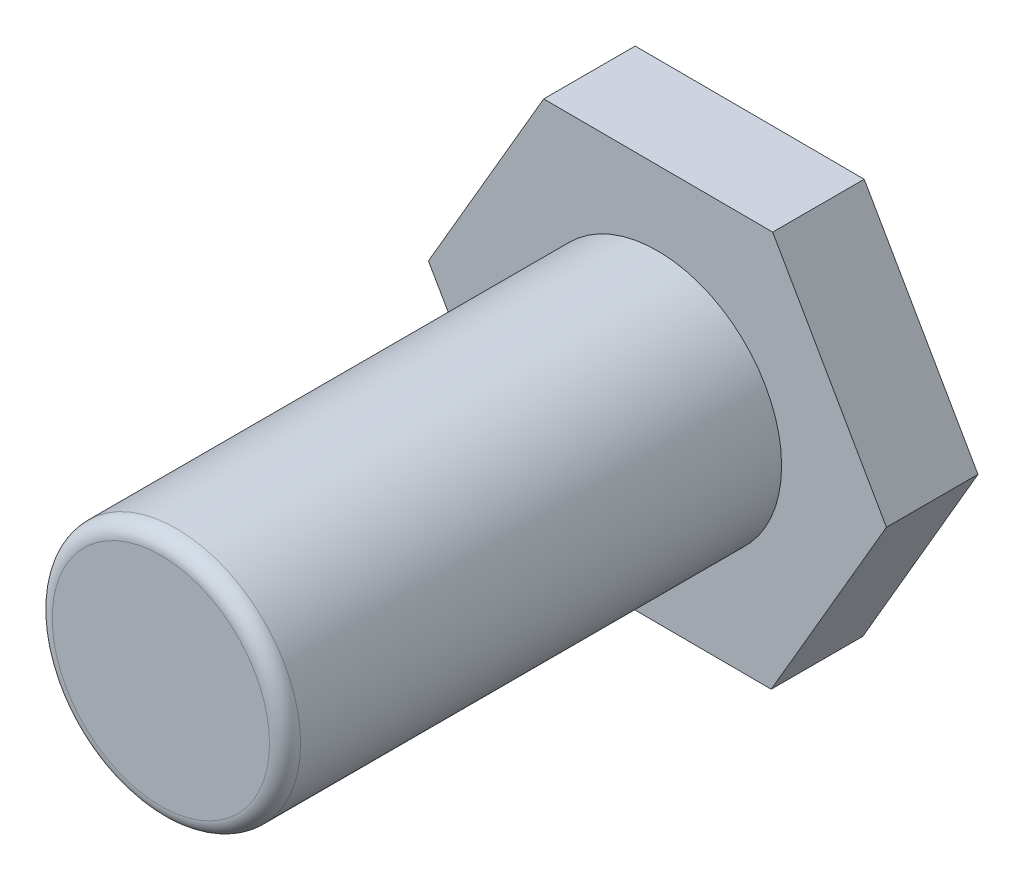
from build123d import *

# Parameters (mm, degrees)
Y_KSEKLIK_EKSTR_ZYON1_DEPTH = 2.95
IZIM3_R                     = 4
Y_KSEKLIK_EKSTR_ZYON2_DEPTH = 16
RADYUS3_R                   = 0.5


with BuildPart() as part:
    # Çizim2 → Yükseklik-Ekstrüzyon1 (new body)
    with BuildSketch(Plane.XY):
        Polygon((3.712848138, 6.376327996), (-3.665637958, 6.403584805), (-7.378486096, 0.02725681), (-3.712848138, -6.376327996), (3.665637958, -6.403584805), (7.378486096, -0.02725681), align=None)
    extrude(amount=Y_KSEKLIK_EKSTR_ZYON1_DEPTH)

    # Çizim3 → Yükseklik-Ekstrüzyon2 (add)
    with BuildSketch(Plane.XY.offset(2.95)):
        Circle(IZIM3_R)
    extrude(amount=Y_KSEKLIK_EKSTR_ZYON2_DEPTH)

    # Radyus3
    radyus3_edges = [part.edges().sort_by_distance(p)[0] for p in [
        (-4, 0, 18.95),
    ]]
    fillet(radyus3_edges, radius=RADYUS3_R)


solid = part.part
